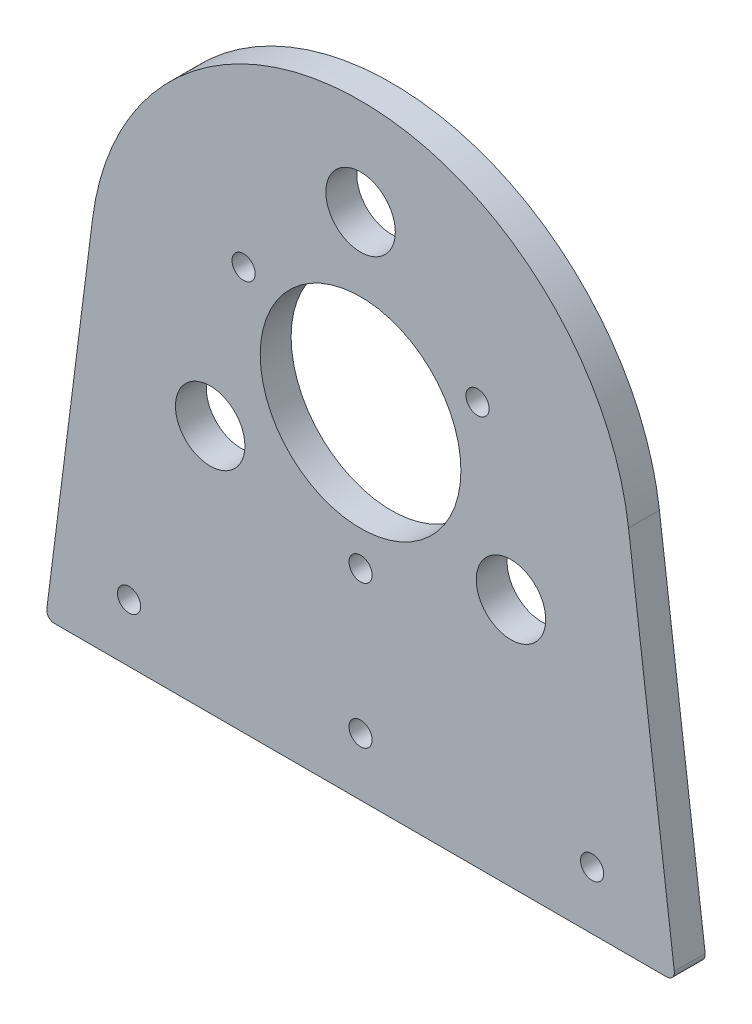
from build123d import *

# Parameters (mm, degrees)
SKETCH_1_R               = 13
EXTRUDE_1_DEPTH          = 4
SKETCH_2_W               = 84
SKETCH_2_H               = 62
EXTRUDE_2_DEPTH          = 4
SKETCH_3_R               = 4.5
CUT_EXTRUDE_1_DEPTH      = 10
SKETCH_4_R               = 1.5
CUT_EXTRUDE_2_DEPTH      = 123.494897853
SKETCH_8_W               = 18
SKETCH_8_H               = 44
EXTRUDE_4_DEPTH          = 4
SKETCH_9_W               = 64
SKETCH_9_H               = 22
CUT_EXTRUDE_6_DEPTH      = 130.772878522
SKETCH_10_R              = 1.5
CUT_EXTRUDE_7_DEPTH      = 130.772878522
SKETCH_11_R              = 1.5
CUT_EXTRUDE_8_DEPTH      = 130.772878522
SKETCH_12_R              = 1.5
CUT_EXTRUDE_9_DEPTH      = 130.772878522
FILLET_1_R               = 3
SKETCH_13_W              = 20
SKETCH_13_H              = 18
CUT_EXTRUDE_10_DEPTH     = 130.772878522
FILLET_2_R               = 3
PATTERN_CIRCULAR_1_COUNT = 3
SKETCH_15_W              = 125.49724571
SKETCH_15_H              = 54.116042209
CUT_EXTRUDE_11_DEPTH     = 130.772878522
FILLET_3_R               = 3
SKETCH_16_R              = 1.5
CUT_EXTRUDE_12_DEPTH     = 97.13012015
SKETCH_17_W              = 168.959633348
SKETCH_17_H              = 62.358711946
CUT_EXTRUDE_13_DEPTH     = 97.13012015
FILLET_4_R               = 1


with BuildPart() as part:
    # 草图1 → 凸台-拉伸1 (new body)
    with BuildSketch(Plane.XY):
        with BuildLine():
            ThreePointArc((34.722027765, 4.402361625), (0, 35), (-34.722027765, 4.402361625))
            Line((-34.722027765, 4.402361625), (-42, -53))
            Line((-42, -53), (42, -53))
            Line((42, -53), (34.722027765, 4.402361625))
        make_face()
        Circle(SKETCH_1_R, mode=Mode.SUBTRACT)
    extrude(amount=EXTRUDE_1_DEPTH)

    # 草图2 → 凸台-拉伸2 (add)
    with BuildSketch(Plane.XY.offset(4)):
        with Locations((0, -84)):
            Rectangle(SKETCH_2_W, SKETCH_2_H)
    extrude(amount=-EXTRUDE_2_DEPTH)

    # 草图3 → 切除-拉伸1 (cut)
    with BuildSketch(Plane.XY.offset(4)):
        with Locations((0, 22.5)):
            Circle(SKETCH_3_R)
    cut_extrude_1 = extrude(amount=-CUT_EXTRUDE_1_DEPTH, mode=Mode.SUBTRACT)

    # 草图4 → 切除-拉伸2 (cut, through all)
    with BuildSketch(Plane.XY.offset(4)):
        with Locations((15.155444566, 8.75)):
            Circle(SKETCH_4_R)
        with Locations((0, -17.5)):
            Circle(SKETCH_4_R)
        with Locations((-15.155444566, 8.75)):
            Circle(SKETCH_4_R)
    extrude(amount=-CUT_EXTRUDE_2_DEPTH, mode=Mode.SUBTRACT)

    # 草图8 → 凸台-拉伸4 (add)
    with BuildSketch(Plane.XY.offset(4)):
        with Locations((-51, -75)):
            Rectangle(SKETCH_8_W, SKETCH_8_H)
    extrude_4 = extrude(amount=-EXTRUDE_4_DEPTH)

    # 镜向3: 凸台-拉伸4 across plane
    add(extrude_4.mirror(Plane(origin=(0, 0, 0), x_dir=(0, 0, 1), z_dir=(1, 0, 0))))

    # 草图9 → 切除-拉伸6 (cut, through all)
    with BuildSketch(Plane(origin=(0, 0, 0), x_dir=(-1, 0, 0), z_dir=(0, 0, -1))):
        with Locations((0, -76)):
            Rectangle(SKETCH_9_W, SKETCH_9_H)
    extrude(amount=-CUT_EXTRUDE_6_DEPTH, mode=Mode.SUBTRACT)

    # 草图10 → 切除-拉伸7 (cut, through all)
    with BuildSketch(Plane(origin=(0, 0, 0), x_dir=(-1, 0, 0), z_dir=(0, 0, -1))):
        with Locations((0, -107.5)):
            Circle(SKETCH_10_R)
        with Locations((24, -107.5)):
            Circle(SKETCH_10_R)
    cut_extrude_7 = extrude(amount=-CUT_EXTRUDE_7_DEPTH, mode=Mode.SUBTRACT)

    # 镜向4: 切除-拉伸7 across plane
    add(cut_extrude_7.mirror(Plane(origin=(0, 0, 0), x_dir=(0, 0, 1), z_dir=(1, 0, 0))), mode=Mode.SUBTRACT)

    # 草图11 → 切除-拉伸8 (cut, through all)
    with BuildSketch(Plane(origin=(0, 0, 0), x_dir=(-1, 0, 0), z_dir=(0, 0, -1))):
        with Locations((-52.5, -67.5)):
            Circle(SKETCH_11_R)
        with Locations((-52.5, -90)):
            Circle(SKETCH_11_R)
    cut_extrude_8 = extrude(amount=-CUT_EXTRUDE_8_DEPTH, mode=Mode.SUBTRACT)

    # 镜向5: 切除-拉伸8 across plane
    add(cut_extrude_8.mirror(Plane(origin=(0, 0, 0), x_dir=(0, 0, 1), z_dir=(1, 0, 0))), mode=Mode.SUBTRACT)

    # 草图12 → 切除-拉伸9 (cut, through all)
    with BuildSketch(Plane(origin=(0, 0, 0), x_dir=(-1, 0, 0), z_dir=(0, 0, -1))):
        with Locations((-30, -36)):
            Circle(SKETCH_12_R)
    cut_extrude_9 = extrude(amount=-CUT_EXTRUDE_9_DEPTH, mode=Mode.SUBTRACT)

    # 镜向6: 切除-拉伸9 across plane
    add(cut_extrude_9.mirror(Plane(origin=(0, 0, 0), x_dir=(0, 0, 1), z_dir=(1, 0, 0))), mode=Mode.SUBTRACT)

    # 圆角1
    fillet_1_edges = [part.edges().sort_by_distance(p)[0] for p in [
        (42, -53, 2),
        (-42, -53, 2),
        (-42, -97, 2),
        (42, -97, 2),
        (-32, -65, 2),
        (-32, -87, 2),
        (32, -87, 2),
        (32, -65, 2),
    ]]
    fillet(fillet_1_edges, radius=FILLET_1_R)

    # 草图13 → 切除-拉伸10 (cut, through all)
    with BuildSketch(Plane(origin=(0, 0, 0), x_dir=(-1, 0, 0), z_dir=(0, 0, -1))):
        with Locations((50, -106)):
            Rectangle(SKETCH_13_W, SKETCH_13_H)
    cut_extrude_10 = extrude(amount=-CUT_EXTRUDE_10_DEPTH, mode=Mode.SUBTRACT)

    # 镜向7: 切除-拉伸10 across plane
    add(cut_extrude_10.mirror(Plane(origin=(0, 0, 0), x_dir=(0, 0, 1), z_dir=(1, 0, 0))), mode=Mode.SUBTRACT)

    # 圆角2
    fillet_2_edges = [part.edges().sort_by_distance(p)[0] for p in [
        (-40, -97, 2),
        (40, -97, 2),
    ]]
    fillet(fillet_2_edges, radius=FILLET_2_R)

    # 阵列(圆周)1: 切除-拉伸1 ×3 about axis
    pattern_circular_1_axis = Axis((0, 0, 0), (0, 0, 1))
    for i in range(1, PATTERN_CIRCULAR_1_COUNT):
        add(cut_extrude_1.rotate(pattern_circular_1_axis, i * 360 / PATTERN_CIRCULAR_1_COUNT), mode=Mode.SUBTRACT)

    # 草图15 → 切除-拉伸11 (cut, through all)
    with BuildSketch(Plane.XY.offset(4)):
        with Locations((2.748622855, -102.058021104)):
            Rectangle(SKETCH_15_W, SKETCH_15_H)
    extrude(amount=-CUT_EXTRUDE_11_DEPTH, mode=Mode.SUBTRACT)

    # 圆角3
    fillet_3_edges = [part.edges().sort_by_distance(p)[0] for p in [
        (32, -75, 2),
        (-32, -75, 2),
    ]]
    fillet(fillet_3_edges, radius=FILLET_3_R)

    # 草图16 → 切除-拉伸12 (cut, through all)
    with BuildSketch(Plane(origin=(0, 0, 0), x_dir=(-1, 0, 0), z_dir=(0, 0, -1))):
        with Locations((0, -36)):
            Circle(SKETCH_16_R)
    extrude(amount=-CUT_EXTRUDE_12_DEPTH, mode=Mode.SUBTRACT)

    # 草图17 → 切除-拉伸13 (cut, through all)
    with BuildSketch(Plane(origin=(0, 0, 0), x_dir=(-1, 0, 0), z_dir=(0, 0, -1))):
        with Locations((4.236961123, -74.679355973)):
            Rectangle(SKETCH_17_W, SKETCH_17_H)
    extrude(amount=-CUT_EXTRUDE_13_DEPTH, mode=Mode.SUBTRACT)

    # 圆角4
    fillet_4_edges = [part.edges().sort_by_distance(p)[0] for p in [
        (40.795507114, -43.5, 2),
        (-40.795507114, -43.5, 2),
    ]]
    fillet(fillet_4_edges, radius=FILLET_4_R)


solid = part.part
